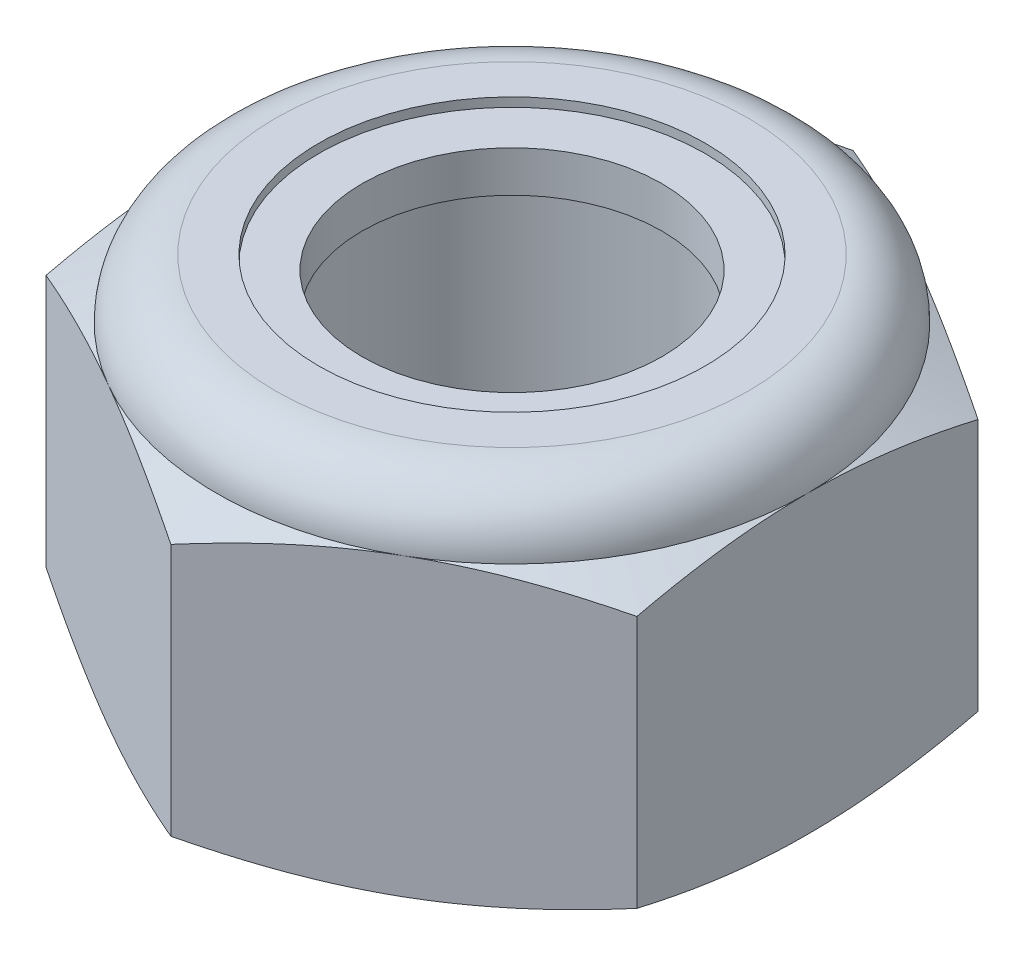
from build123d import *

# Parameters (mm, degrees)
EXTRUDE1_DEPTH = 6
SKETCH2_W      = 3
SKETCH2_H      = 6


with BuildPart() as part:
    # Sketch1 → Extrude1 (new body)
    with BuildSketch(Plane(origin=(0, 0, 0), x_dir=(1, 0, 0), z_dir=(0, 1, 0))):
        Polygon((0, 5.773502692), (-5, 2.886751346), (-5, -2.886751346), (0, -5.773502692), (5, -2.886751346), (5, 2.886751346), align=None)
    extrude(amount=EXTRUDE1_DEPTH)

    # Sketch4 → Cut-Revolve2 (revolve, cut)
    with BuildSketch(Plane(origin=(0, 0, 0), x_dir=(0, 0, -1), z_dir=(1, 0, 0))):
        Polygon((0, 6), (3, 6), (2.538023184, 5.784576673), (2.538023184, 0.215423327), (3, 0), (0, 0), align=None)
    revolve(axis=Axis((0, 6, 0), (0, 1, 0)), mode=Mode.SUBTRACT)


with BuildPart() as body_2:
    # Sketch2 → Revolve1 (revolve)
    with BuildSketch(Plane(origin=(0, 0, 0), x_dir=(0, 0, -1), z_dir=(1, 0, 0))):
        with Locations((1.5, 3)):
            Rectangle(SKETCH2_W, SKETCH2_H)
    revolve(axis=Axis((0, -3, 0), (0, 1, 0)))


with BuildPart() as part_1:
    add(part.part)

    # Combine1: cut body 2
    add(body_2.part, mode=Mode.SUBTRACT)

    # Sketch5 → Cut-Revolve3 (revolve, cut)
    with BuildSketch(Plane(origin=(0, 0, 0), x_dir=(0, 0, -1), z_dir=(1, 0, 0))):
        with BuildLine():
            Line((0, 0), (5, 0))
            Line((5, 0), (5.773502692, 0.360690229))
            Line((5.773502692, 0.360690229), (5.773502692, 4.639309771))
            Line((5.773502692, 4.639309771), (5, 5))
            ThreePointArc((5, 5), (4.707106781, 5.707106781), (4, 6))
            Line((4, 6), (4, 7.27))
            Line((4, 7.27), (7.043502692, 7.27))
            Line((7.043502692, 7.27), (7.043502692, -1.27))
            Line((7.043502692, -1.27), (0, -1.27))
            Line((0, -1.27), (0, 0))
        make_face()
    revolve(axis=Axis((0, 0, 0), (0, 1, 0)), mode=Mode.SUBTRACT)

    # Sketch6 → Cut-Revolve4 (revolve, cut)
    with BuildSketch(Plane(origin=(0, 0, 0), x_dir=(0, 0, -1), z_dir=(1, 0, 0))):
        with BuildLine():
            Line((0, 5), (4.8476, 5))
            ThreePointArc((4.8476, 5), (4.599343708, 5.599343708), (4, 5.8476))
            Line((4, 5.8476), (3.269011592, 5.8476))
            Line((3.269011592, 5.8476), (3.269011592, 7.27))
            Line((3.269011592, 7.27), (0, 7.27))
            Line((0, 7.27), (0, 5))
        make_face()
    revolve(axis=Axis((0, 7.27, 0), (0, 1, 0)), mode=Mode.SUBTRACT)


with BuildPart() as body_2_2:
    # Sketch7 → Revolve2 (revolve)
    with BuildSketch(Plane(origin=(0, 0, 0), x_dir=(0, 0, -1), z_dir=(1, 0, 0))):
        with BuildLine():
            Line((2.538023184, 5.0762), (4.767627201, 5.0762))
            ThreePointArc((4.767627201, 5.0762), (4.51782105, 5.57176859), (4, 5.7714))
            Line((4, 5.7714), (2.538023184, 5.7714))
            Line((2.538023184, 5.7714), (2.538023184, 5.0762))
        make_face()
    revolve(axis=Axis((0, 5.0762, 0), (0, 1, 0)))


solid = Compound([part_1.part, body_2_2.part])
